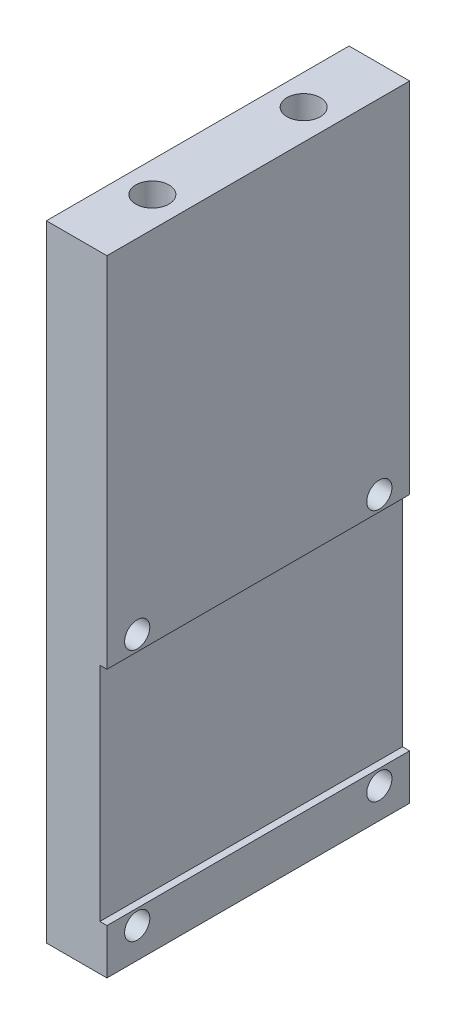
from build123d import *

# Parameters (mm, degrees)
SKETCH_1_W             = 6
SKETCH_1_H             = 30
EXTRUDE_1_DEPTH        = 62
HOLE_WIZARD_M4_1_D     = 3.3
HOLE_WIZARD_M4_1_DEPTH = 10.1
HOLE_WIZARD_M4_1_TIP   = 0.991420021
SKETCH_4_W             = 30
SKETCH_4_H             = 22
CUT_EXTRUDE_1_DEPTH    = 0.7
HOLE_WIZARD_M3_1_D     = 2.5


with BuildPart() as part:
    # 草图1 → 凸台-拉伸1 (new body)
    with BuildSketch(Plane(origin=(0, 0, 0), x_dir=(1, 0, 0), z_dir=(0, 1, 0))):
        Rectangle(SKETCH_1_W, SKETCH_1_H)
    extrude(amount=EXTRUDE_1_DEPTH)

    # M4 螺纹孔1
    with Locations(Plane(origin=(0, 62, 0), x_dir=(1, 0, 0), z_dir=(0, 1, 0))):
        with Locations((0, 7.5), (0, -7.5)):
            Hole(HOLE_WIZARD_M4_1_D / 2, depth=HOLE_WIZARD_M4_1_DEPTH)
            with Locations((0, 0, -(HOLE_WIZARD_M4_1_DEPTH + HOLE_WIZARD_M4_1_TIP / 2))):  # 118° drill point
                Cone(0, HOLE_WIZARD_M4_1_D / 2, HOLE_WIZARD_M4_1_TIP, mode=Mode.SUBTRACT)

    # 草图4 → 切除-拉伸1 (cut)
    with BuildSketch(Plane(origin=(3, 0, 0), x_dir=(0, 0, -1), z_dir=(1, 0, 0))):
        with Locations((0, 15.5)):
            Rectangle(SKETCH_4_W, SKETCH_4_H)
    extrude(amount=-CUT_EXTRUDE_1_DEPTH, mode=Mode.SUBTRACT)

    # M3 螺纹孔1 (through all)
    with Locations(Plane(origin=(3, 0, 0), x_dir=(0, 0, -1), z_dir=(1, 0, 0))):
        with Locations((-12, 28), (12, 28), (12, 3), (-12, 3)):
            Hole(HOLE_WIZARD_M3_1_D / 2)


solid = part.part
